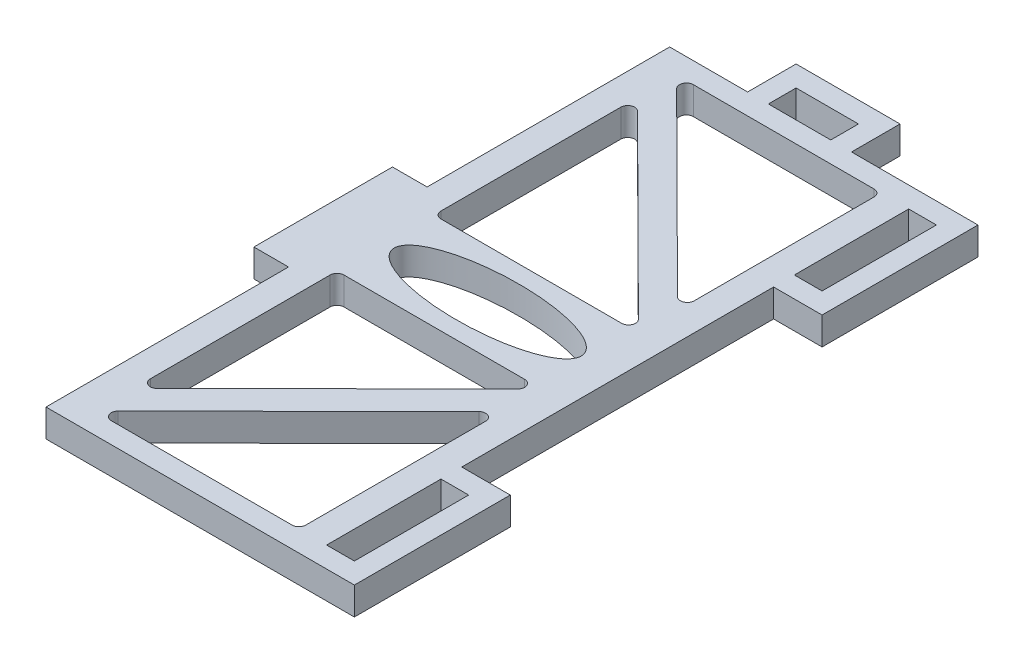
from build123d import *

# Parameters (mm, degrees)
SKETCH1_W           = 4
SKETCH1_H           = 16.5
SKETCH1_W_2         = 9
SKETCH1_H_2         = 4
BOSS_EXTRUDE1_DEPTH = 4
FILLET1_R           = 1
SKETCH2_RX          = 13.5
SKETCH2_RY          = 4.5
CUT_EXTRUDE1_DEPTH  = 59.164099752


with BuildPart() as part:
    # Sketch1 → Boss-Extrude1 (new body)
    with BuildSketch(Plane(origin=(0, 0, 0), x_dir=(1, 0, 0), z_dir=(0, 1, 0))):
        Polygon((-18.75, 45), (-18.75, 10), (-23.75, 10), (-23.75, -10), (-18.75, -10), (-18.75, -45), (25.75, -45), (25.75, -22.5), (18.75, -22.5), (18.75, 22.5), (25.75, 22.5), (25.75, 45), (7.5, 45), (7.5, 52), (-7.5, 52), (-7.5, 45), align=None)
        with Locations((20.75, 33.75)):
            Rectangle(SKETCH1_W, SKETCH1_H, mode=Mode.SUBTRACT)
        with Locations((20.75, -33.75)):
            Rectangle(SKETCH1_W, SKETCH1_H, mode=Mode.SUBTRACT)
        with Locations((0, 47)):
            Rectangle(SKETCH1_W_2, SKETCH1_H_2, mode=Mode.SUBTRACT)
        Polygon((-14.75, 7), (-14.75, 36.356853762), (14.75, 7), align=None, mode=Mode.SUBTRACT)
        Polygon((14.75, 12.643146238), (-14.75, 42), (14.75, 42), align=None, mode=Mode.SUBTRACT)
        Polygon((14.75, -7), (-14.75, -36.356853762), (-14.75, -7), align=None, mode=Mode.SUBTRACT)
        Polygon((14.75, -12.643146238), (14.75, -42), (-14.75, -42), align=None, mode=Mode.SUBTRACT)
    extrude(amount=BOSS_EXTRUDE1_DEPTH)

    # Fillet1
    fillet1_edges = [part.edges().sort_by_distance(p)[0] for p in [
        (-14.75, 2, 42),
        (14.75, 2, 42),
        (14.75, 2, 12.643146238),
        (-14.75, 2, 36.356853762),
        (14.75, 2, 7),
        (-14.75, 2, 7),
        (14.75, 2, -42),
        (-14.75, 2, -42),
        (14.75, 2, -12.643146238),
        (14.75, 2, -7),
        (-14.75, 2, -36.356853762),
        (-14.75, 2, -7),
    ]]
    fillet(fillet1_edges, radius=FILLET1_R)

    # Sketch2 → Cut-Extrude1 (cut, through all)
    with BuildSketch(Plane(origin=(0, 4, 0), x_dir=(1, 0, 0), z_dir=(0, 1, 0))):
        with Locations((0, 0)):
            Ellipse(SKETCH2_RX, SKETCH2_RY)
    extrude(amount=-CUT_EXTRUDE1_DEPTH, mode=Mode.SUBTRACT)


solid = part.part
